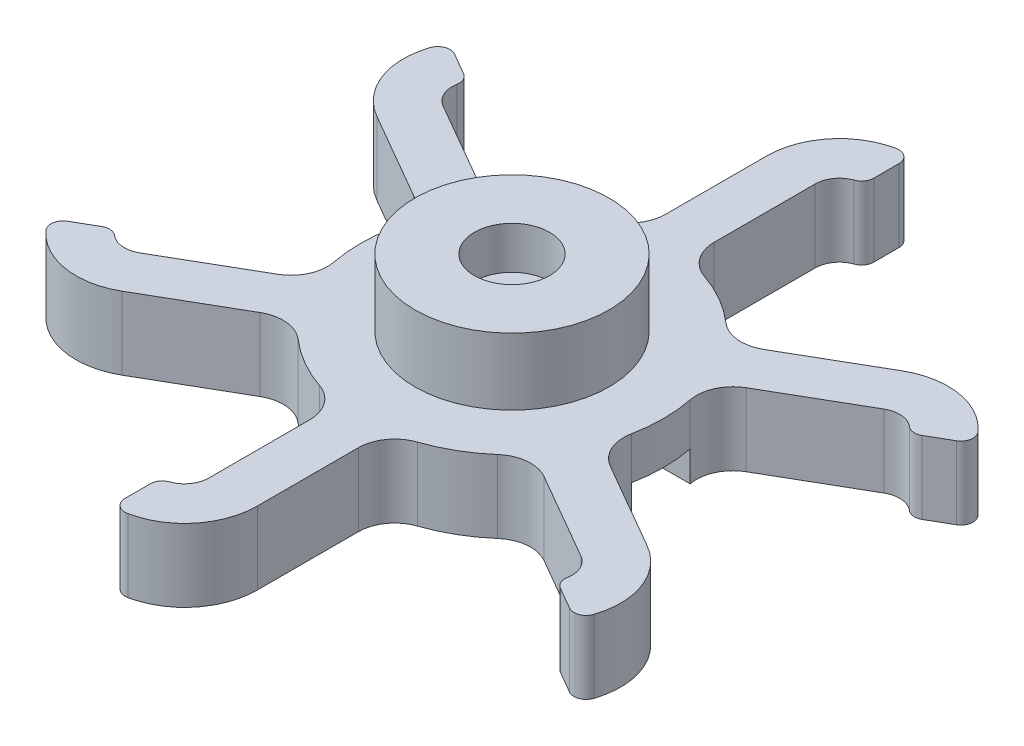
from build123d import *
from build123d.topology import SkipClean

# Parameters (mm, degrees)
EXTRUDE_1_DEPTH      = 6
FILLET_1_R           = 3
FILLET_2_R           = 1
SKETCH_2_R           = 8
EXTRUDE_2_DEPTH      = 2.5
SKETCH_3_R           = 3.1
CUT_EXTRUDE_1_DEPTH  = 41.227129309
SKETCH_5_R           = 8
SKETCH_5_R_2         = 3.1
EXTRUDE_3_DEPTH      = 1.5
SKETCH_6_R           = 8
SKETCH_6_R_2         = 1.25
EXTRUDE_4_DEPTH      = 0.5
SKETCH_7_R           = 8
SKETCH_7_R_2         = 3.1
EXTRUDE_5_DEPTH      = 3.5
EXTRUDE_START        = -3.2
SKETCH_6_2_R         = 8
SKETCH_6_2_R_2       = 1.25
EXTRUDE_6_DEPTH      = 3.2
SKETCH_12_W          = 16
SKETCH_12_H          = 5
CUT_EXTRUDE_7_DEPTH  = 46.830983865
EXTRUDE_7_REACH      = 43.737
SKETCH_16_W          = 0.8
SKETCH_16_H          = 4
SKETCH_14_R          = 1.25
CUT_EXTRUDE_8_DEPTH  = 41.966107118
SKETCH_15_W          = 4.847698962
SKETCH_15_H          = 5
CUT_EXTRUDE_9_DEPTH  = 46.830983865
CUT_EXTRUDE_10_REACH = 42.697
SKETCH_17_R          = 1.55


with BuildPart() as part:
    # 草图1 → 凸台-拉伸1 (new body)
    with BuildSketch(Plane(origin=(0, 0, 0), x_dir=(1, 0, 0), z_dir=(0, 1, 0))):
        with BuildLine():
            Line((2, 12.338962679), (2, 23))
            ThreePointArc((2, 23), (2.585786438, 24.414213562), (4, 25))
            Line((4, 25), (4, 29))
            ThreePointArc((4, 29), (-0.242640687, 27.242640687), (-2, 23))
            Line((-2, 23), (-2, 12.338962679))
            ThreePointArc((-2, 12.338962679), (-6.25, 10.825317547), (-9.685855137, 7.901532147))
            Line((-9.685855137, 7.901532147), (-18.918584287, 13.232050808))
            ThreePointArc((-18.918584287, 13.232050808), (-19.85043594, 14.446463525), (-19.650635095, 15.964101615))
            Line((-19.650635095, 15.964101615), (-23.11473671, 17.964101615))
            ThreePointArc((-23.11473671, 17.964101615), (-23.714139245, 13.411187345), (-20.918584287, 9.767949192))
            Line((-20.918584287, 9.767949192), (-11.685855137, 4.437430532))
            ThreePointArc((-11.685855137, 4.437430532), (-12.5, 0), (-11.685855137, -4.437430532))
            Line((-11.685855137, -4.437430532), (-20.918584287, -9.767949192))
            ThreePointArc((-20.918584287, -9.767949192), (-22.436222377, -9.967750037), (-23.650635095, -9.035898385))
            Line((-23.650635095, -9.035898385), (-27.11473671, -11.035898385))
            ThreePointArc((-27.11473671, -11.035898385), (-23.471498558, -13.831453343), (-18.918584287, -13.232050808))
            Line((-18.918584287, -13.232050808), (-9.685855137, -7.901532147))
            ThreePointArc((-9.685855137, -7.901532147), (-6.25, -10.825317547), (-2, -12.338962679))
            Line((-2, -12.338962679), (-2, -23))
            ThreePointArc((-2, -23), (-2.585786438, -24.414213562), (-4, -25))
            Line((-4, -25), (-4, -29))
            ThreePointArc((-4, -29), (0.242640687, -27.242640687), (2, -23))
            Line((2, -23), (2, -12.338962679))
            ThreePointArc((2, -12.338962679), (6.25, -10.825317547), (9.685855137, -7.901532147))
            Line((9.685855137, -7.901532147), (18.918584287, -13.232050808))
            ThreePointArc((18.918584287, -13.232050808), (19.85043594, -14.446463525), (19.650635095, -15.964101615))
            Line((19.650635095, -15.964101615), (23.11473671, -17.964101615))
            ThreePointArc((23.11473671, -17.964101615), (23.714139245, -13.411187345), (20.918584287, -9.767949192))
            Line((20.918584287, -9.767949192), (11.685855137, -4.437430532))
            ThreePointArc((11.685855137, -4.437430532), (12.5, 0), (11.685855137, 4.437430532))
            Line((11.685855137, 4.437430532), (20.918584287, 9.767949192))
            ThreePointArc((20.918584287, 9.767949192), (22.436222377, 9.967750037), (23.650635095, 9.035898385))
            Line((23.650635095, 9.035898385), (27.11473671, 11.035898385))
            ThreePointArc((27.11473671, 11.035898385), (23.471498558, 13.831453343), (18.918584287, 13.232050808))
            Line((18.918584287, 13.232050808), (9.685855137, 7.901532147))
            ThreePointArc((9.685855137, 7.901532147), (6.25, 10.825317547), (2, 12.338962679))
        make_face()
    extrude(amount=EXTRUDE_1_DEPTH)

    # 圆角1
    fillet_1_edges = [part.edges().sort_by_distance(p)[0] for p in [
        (9.685855137, 3, -7.901532147),
        (2, 3, -12.338962679),
        (-2, 3, -12.338962679),
        (-9.685855137, 3, -7.901532147),
        (-11.685855137, 3, -4.437430532),
        (-11.685855137, 3, 4.437430532),
        (-9.685855137, 3, 7.901532147),
        (-2, 3, 12.338962679),
        (2, 3, 12.338962679),
        (11.685855137, 3, 4.437430532),
        (9.685855137, 3, 7.901532147),
        (11.685855137, 3, -4.437430532),
    ]]
    fillet(fillet_1_edges, radius=FILLET_1_R)

    # 圆角2
    fillet_2_edges = [part.edges().sort_by_distance(p)[0] for p in [
        (-4, 3, 25),
        (-27.11473671, 3, 11.035898385),
        (-23.650635095, 3, 9.035898385),
        (-23.11473671, 3, -17.964101615),
        (-19.650635095, 3, -15.964101615),
        (4, 3, -29),
        (4, 3, -25),
        (27.11473671, 3, -11.035898385),
        (23.650635095, 3, -9.035898385),
        (19.650635095, 3, 15.964101615),
        (23.11473671, 3, 17.964101615),
        (-4, 3, 29),
    ]]
    fillet(fillet_2_edges, radius=FILLET_2_R)

    # 草图2 → 凸台-拉伸2 (add)
    with BuildSketch(Plane(origin=(0, 0, 0), x_dir=(1, 0, 0), z_dir=(0, 1, 0))):
        Circle(SKETCH_2_R)
    extrude(amount=-EXTRUDE_2_DEPTH)

    # 草图3 → 切除-拉伸1 (cut, through all)
    with BuildSketch(Plane(origin=(0, -2.5, 0), x_dir=(-1, 0, 0), z_dir=(0, -1, 0))):
        Circle(SKETCH_3_R)
    extrude(amount=-CUT_EXTRUDE_1_DEPTH, mode=Mode.SUBTRACT)

    # 草图5 → 凸台-拉伸3 (add)
    with SkipClean():  # the faces are left unmerged after this step: merging them gives an invalid solid
        with BuildSketch(Plane(origin=(0, 6, 0), x_dir=(1, 0, 0), z_dir=(0, 1, 0))):
            Circle(SKETCH_5_R)
            Circle(SKETCH_5_R_2, mode=Mode.SUBTRACT)
        extrude(amount=EXTRUDE_3_DEPTH)

    # 草图6 → 凸台-拉伸4 (add)
    with SkipClean():  # the faces are left unmerged after this step: merging them gives an invalid solid
        with BuildSketch(Plane(origin=(0, 7.5, 0), x_dir=(1, 0, 0), z_dir=(0, 1, 0))):
            Circle(SKETCH_6_R)
            Circle(SKETCH_6_R_2, mode=Mode.SUBTRACT)
        extrude(amount=EXTRUDE_4_DEPTH)

    # 草图7 → 凸台-拉伸5 (add)
    with SkipClean():  # the faces are left unmerged after this step: merging them gives an invalid solid
        with BuildSketch(Plane(origin=(0, 8, 0), x_dir=(1, 0, 0), z_dir=(0, 1, 0))):
            Circle(SKETCH_7_R)
            Circle(SKETCH_7_R_2, mode=Mode.SUBTRACT)
        extrude(amount=EXTRUDE_5_DEPTH)

    # 草图6<2> → 凸台-拉伸6 (add)
    with BuildSketch(Plane(origin=(0, 7.5, 0), x_dir=(1, 0, 0), z_dir=(0, 1, 0)).offset(EXTRUDE_START)):
        Circle(SKETCH_6_2_R)
        Circle(SKETCH_6_2_R_2, mode=Mode.SUBTRACT)
    extrude(amount=EXTRUDE_6_DEPTH)

    # 草图12 → 切除-拉伸7 (cut, through all)
    with BuildSketch(Plane(origin=(7, 0, 0), x_dir=(0, 0, -1), z_dir=(1, 0, 0))):
        with Locations((0, -2.5)):
            Rectangle(SKETCH_12_W, SKETCH_12_H)
    extrude(amount=CUT_EXTRUDE_7_DEPTH, mode=Mode.SUBTRACT)

    # 草图16 → 凸台-拉伸7 (add, up to next)
    with BuildSketch(Plane.XZ.offset(2.5), mode=Mode.PRIVATE) as extrude_7_sk1:
        with Locations((3.1, 0)):
            Rectangle(SKETCH_16_W, SKETCH_16_H)
    extrude_7_tool1 = extrude(extrude_7_sk1.sketch, amount=-EXTRUDE_7_REACH, mode=Mode.PRIVATE) - part.part
    add(extrude_7_tool1.solids().sort_by_distance((3.1, -2.5, 0))[0])

    # 草图14 → 切除-拉伸8 (cut, through all)
    with BuildSketch(Plane(origin=(0, 0, 0), x_dir=(0, 0, -1), z_dir=(1, 0, 0))):
        Circle(SKETCH_14_R)
    extrude(amount=CUT_EXTRUDE_8_DEPTH, mode=Mode.SUBTRACT)

    # 草图15 → 切除-拉伸9 (cut, through all)
    with BuildSketch(Plane(origin=(7, 0, 0), x_dir=(0, 0, -1), z_dir=(1, 0, 0))):
        Rectangle(SKETCH_15_W, SKETCH_15_H)
    extrude(amount=CUT_EXTRUDE_9_DEPTH, mode=Mode.SUBTRACT)

    # 草图17 → 切除-拉伸10 (cut, up to next)
    with BuildSketch(Plane(origin=(0, 8, 0), x_dir=(1, 0, 0), z_dir=(0, 1, 0)), mode=Mode.PRIVATE) as cut_extrude_10_sk1:
        Circle(SKETCH_17_R)
    cut_extrude_10_tool1 = extrude(cut_extrude_10_sk1.sketch, amount=-CUT_EXTRUDE_10_REACH, mode=Mode.PRIVATE) & part.part
    add(cut_extrude_10_tool1.solids().sort_by_distance((0, 8, 0))[0], mode=Mode.SUBTRACT)


solid = part.part
